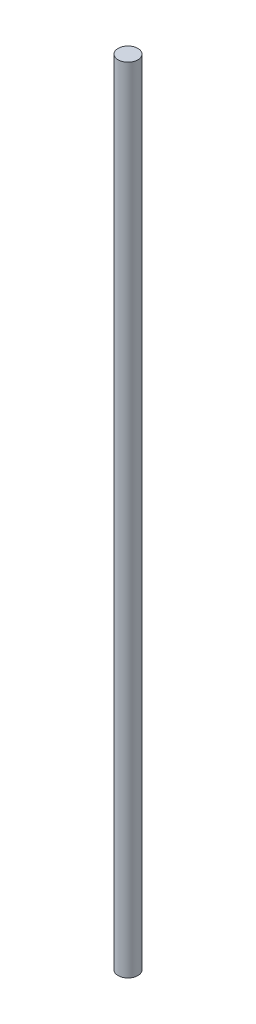
from build123d import *

# Parameters (mm, degrees)
SKETCH1_R           = 1.5
BOSS_EXTRUDE1_DEPTH = 120


with BuildPart() as part:
    # Sketch1 → Boss-Extrude1 (new body)
    with BuildSketch(Plane(origin=(0, 0, 0), x_dir=(1, 0, 0), z_dir=(0, 1, 0))):
        with Locations(Location((0, 0, 0), (0, 0, 270))):
            Circle(SKETCH1_R)
    extrude(amount=BOSS_EXTRUDE1_DEPTH)


solid = part.part
